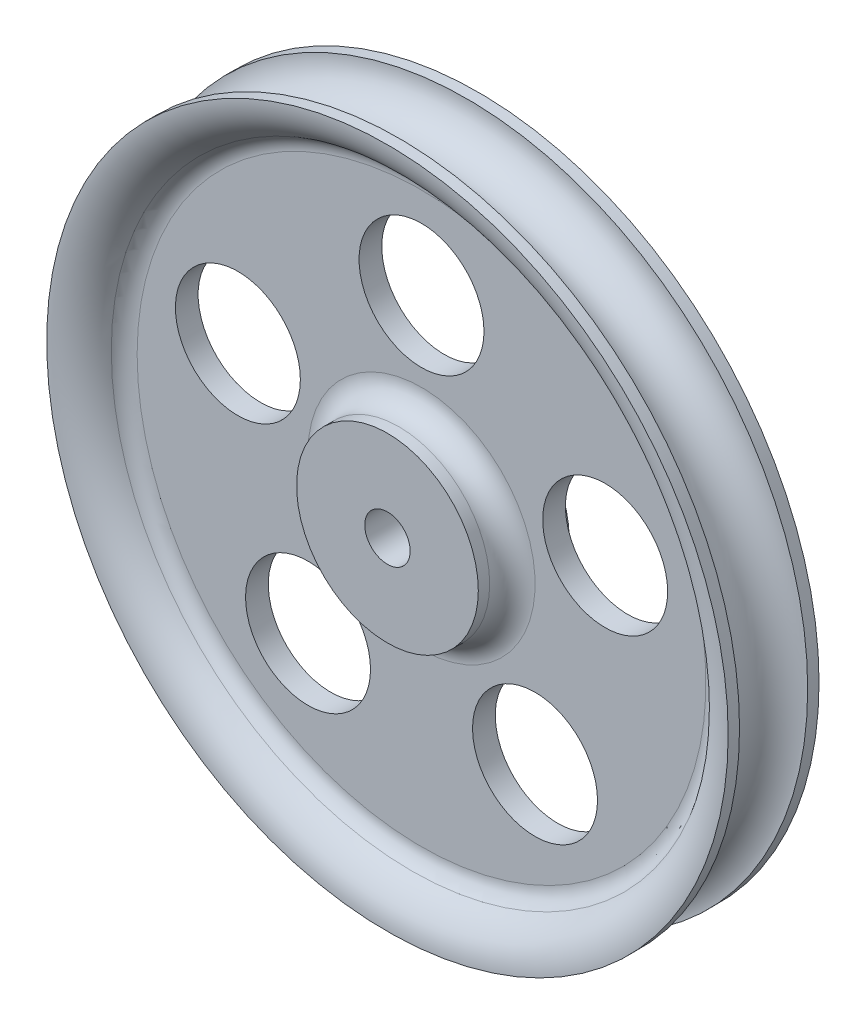
from build123d import *

# Parameters (mm, degrees)
SKETCH2_R          = 34.925
CUT_EXTRUDE1_DEPTH = 272.272118914
CIRPATTERN1_COUNT  = 5
FILLET1_R          = 10.16
FILLET2_R          = 12.7


with BuildPart() as part:
    # Sketch1 → Revolve1 (revolve)
    with BuildSketch(Plane(origin=(0, 0, 0), x_dir=(0, 0, -1), z_dir=(1, 0, 0)), mode=Mode.PRIVATE) as revolve1_sk:
        with BuildLine():
            Line((-19.05, 190.5), (-25.4, 190.5))
            ThreePointArc((-25.4, 190.5), (-20.080463142, 174.945740133), (-6.35, 165.906555752))
            Line((-6.35, 165.906555752), (-6.35, 50.8))
            Line((-6.35, 50.8), (-25.4, 50.8))
            Line((-25.4, 50.8), (-25.4, 12.7))
            Line((-25.4, 12.7), (25.4, 12.7))
            Line((25.4, 12.7), (25.4, 50.8))
            Line((25.4, 50.8), (6.35, 50.8))
            Line((6.35, 50.8), (6.35, 165.906555752))
            ThreePointArc((6.35, 165.906555752), (20.080463142, 174.945740133), (25.4, 190.5))
            Line((25.4, 190.5), (19.05, 190.5))
            ThreePointArc((19.05, 190.5), (0, 171.45), (-19.05, 190.5))
        make_face()
    revolve(revolve1_sk.sketch.rotate(Axis((0, 0, 136.652714826), (0, 0, -1)), 90), axis=Axis((0, 0, 136.652714826), (0, 0, -1)))

    # Sketch2 → Cut-Extrude1 (cut, through all)
    with BuildSketch(Plane.XY.offset(6.35)):
        with Locations((0, 107.95)):
            Circle(SKETCH2_R)
    cut_extrude1 = extrude(amount=-CUT_EXTRUDE1_DEPTH, mode=Mode.SUBTRACT)

    # CirPattern1: Cut-Extrude1 ×5 about axis
    cirpattern1_axis = Axis((0, 0, 0), (0, 0, 1))
    for i in range(1, CIRPATTERN1_COUNT):
        add(cut_extrude1.rotate(cirpattern1_axis, i * 360 / CIRPATTERN1_COUNT), mode=Mode.SUBTRACT)

    # Fillet1
    fillet1_edges = [part.edges().sort_by_distance(p)[0] for p in [
        (-165.906555752, 0, -6.35),
        (-165.906555752, 0, 6.35),
    ]]
    fillet(fillet1_edges, radius=FILLET1_R)

    # Fillet2
    fillet2_edges = [part.edges().sort_by_distance(p)[0] for p in [
        (-50.8, 0, -6.35),
        (-50.8, 0, 6.35),
    ]]
    fillet(fillet2_edges, radius=FILLET2_R)


solid = part.part
